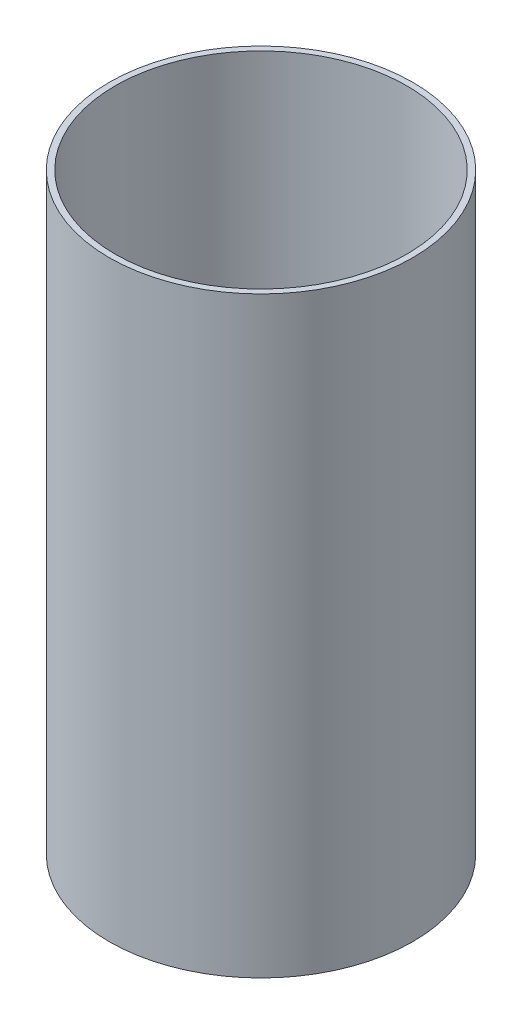
from build123d import *

# Parameters (mm, degrees)
SKETCH1_R           = 76
SKETCH1_R_2         = 73
BOSS_EXTRUDE1_DEPTH = 296.5


with BuildPart() as part:
    # Sketch1 → Boss-Extrude1 (new body)
    with BuildSketch(Plane(origin=(0, 0, 0), x_dir=(1, 0, 0), z_dir=(0, 1, 0))):
        with Locations(Location((0, 0, 0), (0, 0, 270))):
            Circle(SKETCH1_R)
        with Locations(Location((0, 0, 0), (0, 0, 270))):
            Circle(SKETCH1_R_2, mode=Mode.SUBTRACT)
    extrude(amount=BOSS_EXTRUDE1_DEPTH)


solid = part.part
